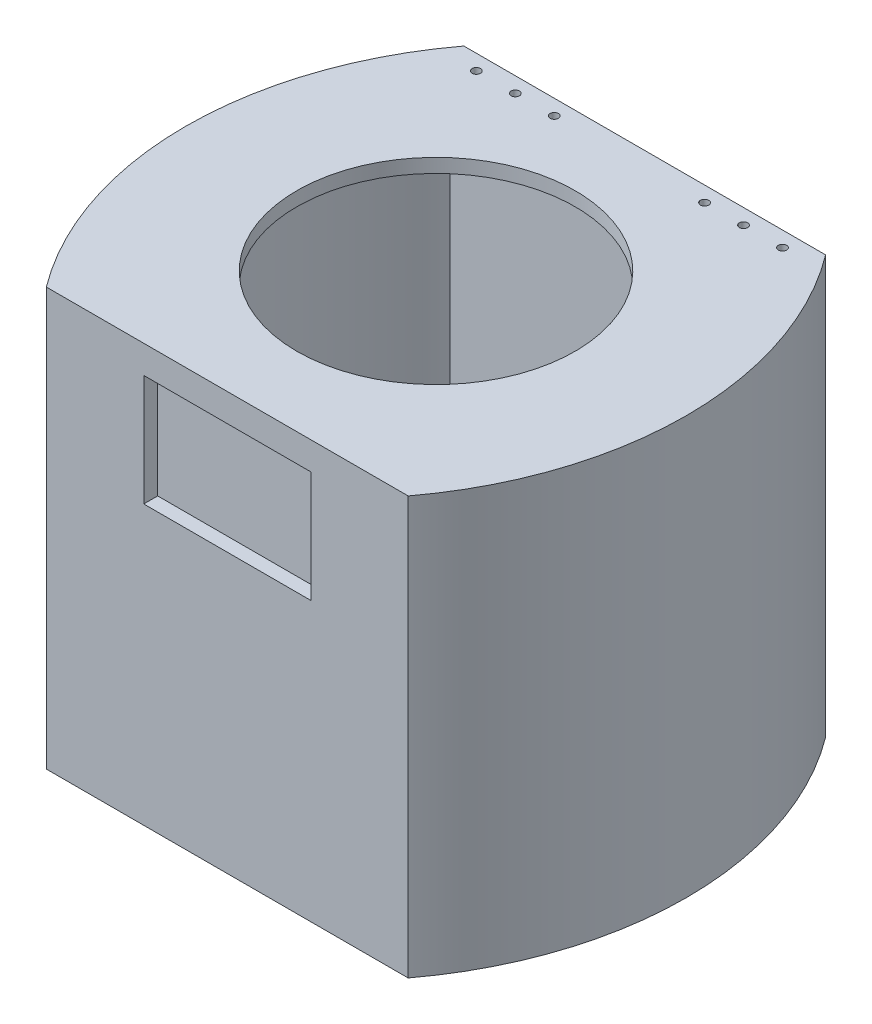
from build123d import *

# Parameters (mm, degrees)
BOSS_EXTRUDE1_DEPTH      = 300
CUT_EXTRUDE8_DEPTH       = 280
COMPARTMENT_INPUT_R      = 100
CUT_EXTRUDE1_DEPTH       = 240
LCD_W                    = 120
LCD_H                    = 80
CUT_EXTRUDE2_DEPTH       = 10
HINGE_HOLES_R            = 3
CUT_EXTRUDE3_DEPTH       = 20
POLES_FOR_MIDDLE_LAYER_R = 17.5
BOSS_EXTRUDE2_DEPTH      = 110
HOLES_FOR_POLES_R        = 12.5
CUT_EXTRUDE6_DEPTH       = 50
CUT_EXTRUDE9_REACH       = 382.657
POWER_SUPPLY_HOLES_R     = 3.5


with BuildPart() as part:
    # Case 2 → Boss-Extrude1 (new body)
    with BuildSketch(Plane(origin=(0, 0, 0), x_dir=(1, 0, 0), z_dir=(0, 1, 0))):
        with BuildLine():
            Line((-130, 150), (130, 150))
            ThreePointArc((130, 150), (180, 0), (130, -150))
            Line((130, -150), (-130, -150))
            ThreePointArc((-130, -150), (-180, 0), (-130, 150))
        make_face()
    extrude(amount=BOSS_EXTRUDE1_DEPTH)

    # Hollow compartment → Cut-Extrude8 (cut)
    with BuildSketch(Plane(origin=(0, 290, 0), x_dir=(1, 0, 0), z_dir=(0, 1, 0))):
        with BuildLine():
            Line((-120, 130), (120, 130))
            ThreePointArc((120, 130), (158.257589982, 0), (120, -130))
            Line((120, -130), (-120, -130))
            ThreePointArc((-120, -130), (-158.257589982, 0), (-120, 130))
        make_face()
    extrude(amount=-CUT_EXTRUDE8_DEPTH, mode=Mode.SUBTRACT)

    # Compartment Input → Cut-Extrude1 (cut)
    with BuildSketch(Plane(origin=(0, 300, 0), x_dir=(1, 0, 0), z_dir=(0, 1, 0))):
        with Locations(Location((0, 0, 0), (0, 0, 270))):
            Circle(COMPARTMENT_INPUT_R)
    extrude(amount=-CUT_EXTRUDE1_DEPTH, mode=Mode.SUBTRACT)

    # LCD → Cut-Extrude2 (cut)
    with BuildSketch(Plane.XY.offset(150)):
        with Locations((0, 240)):
            Rectangle(LCD_W, LCD_H)
    extrude(amount=-CUT_EXTRUDE2_DEPTH, mode=Mode.SUBTRACT)

    # Hinge holes → Cut-Extrude3 (cut)
    with BuildSketch(Plane(origin=(0, 300, 0), x_dir=(1, 0, 0), z_dir=(0, 1, 0))):
        with Locations(Location((-110, 139, 0), (0, 0, 270))):
            Circle(HINGE_HOLES_R)
        with Locations(Location((-82, 139, 0), (0, 0, 270))):
            Circle(HINGE_HOLES_R)
        with Locations(Location((-54, 139, 0), (0, 0, 270))):
            Circle(HINGE_HOLES_R)
        with Locations(Location((54, 139, 0), (0, 0, 270))):
            Circle(HINGE_HOLES_R)
        with Locations(Location((82, 139, 0), (0, 0, 270))):
            Circle(HINGE_HOLES_R)
        with Locations(Location((110, 139, 0), (0, 0, 270))):
            Circle(HINGE_HOLES_R)
    extrude(amount=-CUT_EXTRUDE3_DEPTH, mode=Mode.SUBTRACT)

    # Poles for middle layer → Boss-Extrude2 (add)
    with BuildSketch(Plane(origin=(0, 10, 0), x_dir=(1, 0, 0), z_dir=(0, 1, 0))):
        with Locations(Location((0, 90, 0), (0, 0, 270))):
            Circle(POLES_FOR_MIDDLE_LAYER_R)
        with Locations(Location((0, -90, 0), (0, 0, 270))):
            Circle(POLES_FOR_MIDDLE_LAYER_R)
    extrude(amount=BOSS_EXTRUDE2_DEPTH)

    # Holes for poles → Cut-Extrude6 (cut)
    with BuildSketch(Plane(origin=(0, 120, 0), x_dir=(1, 0, 0), z_dir=(0, 1, 0))):
        with Locations(Location((0, -90, 0), (0, 0, 270))):
            Circle(HOLES_FOR_POLES_R)
        with Locations(Location((0, 90, 0), (0, 0, 270))):
            Circle(HOLES_FOR_POLES_R)
    extrude(amount=-CUT_EXTRUDE6_DEPTH, mode=Mode.SUBTRACT)

    # Power supply holes → Cut-Extrude9 (cut, up to next)
    with BuildSketch(Plane(origin=(0, 0, 0), x_dir=(1, 0, 0), z_dir=(0, 1, 0)), mode=Mode.PRIVATE) as cut_extrude9_sk1:
        with Locations(Location((-82.5, 40, 0), (0, 0, 90))):
            Circle(POWER_SUPPLY_HOLES_R)
    cut_extrude9_tool1 = extrude(cut_extrude9_sk1.sketch, amount=CUT_EXTRUDE9_REACH, mode=Mode.PRIVATE) & part.part
    # Power supply holes → Cut-Extrude9 (cut, up to next)
    with BuildSketch(Plane(origin=(0, 0, 0), x_dir=(1, 0, 0), z_dir=(0, 1, 0)), mode=Mode.PRIVATE) as cut_extrude9_sk2:
        with Locations(Location((37.5, 40, 0), (0, 0, 90))):
            Circle(POWER_SUPPLY_HOLES_R)
    cut_extrude9_tool2 = extrude(cut_extrude9_sk2.sketch, amount=CUT_EXTRUDE9_REACH, mode=Mode.PRIVATE) & part.part
    # Power supply holes → Cut-Extrude9 (cut, up to next)
    with BuildSketch(Plane(origin=(0, 0, 0), x_dir=(1, 0, 0), z_dir=(0, 1, 0)), mode=Mode.PRIVATE) as cut_extrude9_sk3:
        with Locations(Location((37.5, -40, 0), (0, 0, 90))):
            Circle(POWER_SUPPLY_HOLES_R)
    cut_extrude9_tool3 = extrude(cut_extrude9_sk3.sketch, amount=CUT_EXTRUDE9_REACH, mode=Mode.PRIVATE) & part.part
    # Power supply holes → Cut-Extrude9 (cut, up to next)
    with BuildSketch(Plane(origin=(0, 0, 0), x_dir=(1, 0, 0), z_dir=(0, 1, 0)), mode=Mode.PRIVATE) as cut_extrude9_sk4:
        with Locations(Location((-82.5, -40, 0), (0, 0, 90))):
            Circle(POWER_SUPPLY_HOLES_R)
    cut_extrude9_tool4 = extrude(cut_extrude9_sk4.sketch, amount=CUT_EXTRUDE9_REACH, mode=Mode.PRIVATE) & part.part
    add(cut_extrude9_tool1.solids().sort_by_distance((-82.5, 0, -40))[0], mode=Mode.SUBTRACT)
    add(cut_extrude9_tool2.solids().sort_by_distance((37.5, 0, -40))[0], mode=Mode.SUBTRACT)
    add(cut_extrude9_tool3.solids().sort_by_distance((37.5, 0, 40))[0], mode=Mode.SUBTRACT)
    add(cut_extrude9_tool4.solids().sort_by_distance((-82.5, 0, 40))[0], mode=Mode.SUBTRACT)


solid = part.part
